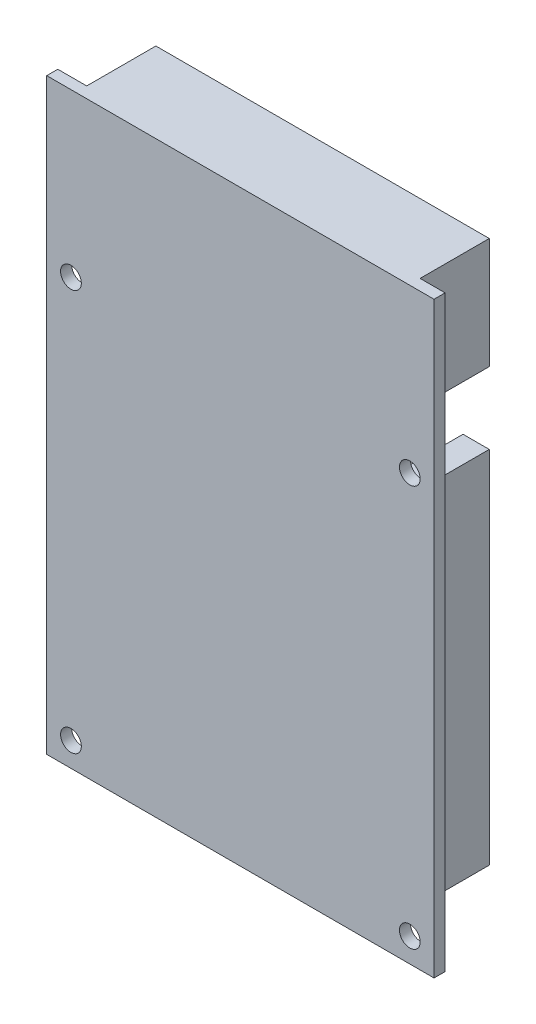
from build123d import *

# Parameters (mm, degrees)
SKETCH_1_R      = 1.5
EXTRUDE_1_DEPTH = 1.6
SKETCH_2_W      = 48.207961956
SKETCH_2_H      = 16.049260915
SKETCH_2_W_2    = 3.793795092
SKETCH_2_H_2    = 52.066933367
EXTRUDE_2_DEPTH = 10


with BuildPart() as part:
    # 草图1 → 凸台-拉伸1 (new body)
    with BuildSketch(Plane.XY):
        Polygon((-13.183660203, 74.386417716), (-13.183660203, -7.113582284), (-13.183660203, -10.613582284), (42.816339797, -10.613582284), (42.816339797, 74.386417716), align=None)
        with BuildLine():
            ThreePointArc((-8.183660203, -7.113582284), (-9.683660203, -8.613582284), (-11.183660203, -7.113582284))
            ThreePointArc((-11.183660203, -7.113582284), (-9.683660203, -5.613582284), (-8.183660203, -7.113582284))
        make_face(mode=Mode.SUBTRACT)
        with Locations((39.316339797, -7.113582284)):
            Circle(SKETCH_1_R, mode=Mode.SUBTRACT)
        with Locations((-9.683660203, 50.886417716)):
            Circle(SKETCH_1_R, mode=Mode.SUBTRACT)
        with Locations((39.316339797, 50.886417716)):
            Circle(SKETCH_1_R, mode=Mode.SUBTRACT)
    extrude(amount=EXTRUDE_1_DEPTH)

    # 草图2 → 凸台-拉伸2 (add)
    with BuildSketch(Plane(origin=(0, 0, 0), x_dir=(-1, 0, 0), z_dir=(0, 0, -1))):
        with Locations((-15.098918569, 66.361787259)):
            Rectangle(SKETCH_2_W, SKETCH_2_H)
        with Locations((-37.306002001, 21.941048421)):
            Rectangle(SKETCH_2_W_2, SKETCH_2_H_2)
    extrude(amount=EXTRUDE_2_DEPTH)


solid = part.part
